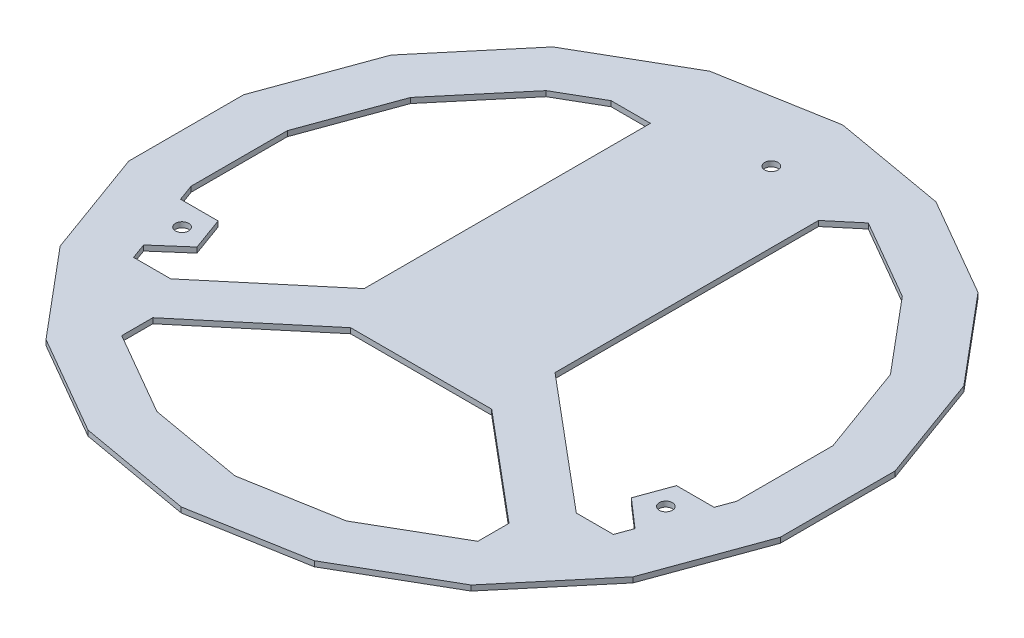
from build123d import *

# Parameters (mm, degrees)
BOSS_EXTRUDE1_DEPTH    = 1.2
BOSS_EXTRUDE17_DEPTH   = 1.2
BOSS_EXTRUDE17_2_DEPTH = 1.2
BOSS_EXTRUDE17_3_DEPTH = 1.2
SKETCH18_W             = 18
SKETCH18_H             = 25
BOSS_EXTRUDE18_DEPTH   = 1.2
BOSS_EXTRUDE19_DEPTH   = 1.2
BOSS_EXTRUDE20_DEPTH   = 1.2
BOSS_EXTRUDE22_DEPTH   = 1.2
BOSS_EXTRUDE26_DEPTH   = 1.2
BOSS_EXTRUDE28_DEPTH   = 1.2
BOSS_EXTRUDE23_DEPTH   = 1.2
SKETCH38_R             = 1.5
CUT_EXTRUDE2_DEPTH     = 1.2
BOSS_EXTRUDE29_DEPTH   = 1.2
SKETCH37_R             = 1.5
CUT_EXTRUDE3_DEPTH     = 1.2
BOSS_EXTRUDE30_DEPTH   = 1.2
CUT_EXTRUDE4_DEPTH     = 1.2


with BuildPart() as part:
    # Sketch1 → Boss-Extrude1 (new body)
    with BuildSketch(Plane(origin=(0, 0, 0), x_dir=(1, 0, 0), z_dir=(0, 1, 0))):
        Polygon((0, 75), (-25.651510749, 70.476946559), (-48.209070726, 57.453333234), (-64.951905284, 37.5), (-73.860581476, 13.023613325), (-73.860581476, -13.023613325), (-64.951905284, -37.5), (-48.209070726, -57.453333234), (-25.651510749, -70.476946559), (0, -75), (25.651510749, -70.476946559), (48.209070726, -57.453333234), (64.951905284, -37.5), (73.860581476, -13.023613325), (73.860581476, 13.023613325), (64.951905284, 37.5), (48.209070726, 57.453333234), (25.651510749, 70.476946559), align=None)
        Polygon((0, 62.814880657), (-21.483954485, 59.026679829), (-40.37662699, 48.118990273), (-54.399282385, 31.407440329), (-61.860581476, 10.907689557), (-61.860581476, -10.907689557), (-54.399282385, -31.407440329), (-40.37662699, -48.118990273), (-21.483954485, -59.026679829), (0, -62.814880657), (21.483954485, -59.026679829), (40.37662699, -48.118990273), (54.399282385, -31.407440329), (61.860581476, -10.907689557), (61.860581476, 10.907689557), (54.399282385, 31.407440329), (40.37662699, 48.118990273), (21.483954485, 59.026679829), align=None, mode=Mode.SUBTRACT)
    extrude(amount=BOSS_EXTRUDE1_DEPTH)



with BuildPart() as body_2:
    # Sketch15 → Boss-Extrude17 (new body)
    with BuildSketch(Plane.XZ):
        Polygon((0, -101.401091909), (34.681215988, -95.285857807), (36.930290738, -93.987353894), (36.930290738, -84.749749587), (31.902845145, -87.652346653), (0, -93.277679014), (-31.902845145, -87.652346653), (-36.930290738, -84.749749587), (-36.930290738, -93.987353894), (-34.681215988, -95.285857807), align=None)
    extrude(amount=-BOSS_EXTRUDE17_DEPTH)


with BuildPart() as body_3:
    # Sketch15 → Boss-Extrude17 2 (new body)
    with BuildSketch(Plane.XZ):
        Polygon((92.620527368, -37.5), (99.860581476, -17.608114823), (99.860581476, 17.608114823), (92.620527368, 37.5), (84.107105188, 37.5), (91.860581476, 16.197498978), (91.860581476, -16.197498978), (84.107105188, -37.5), align=None)
    extrude(amount=-BOSS_EXTRUDE17_2_DEPTH)


with BuildPart() as body_4:
    # Sketch15 → Boss-Extrude17 3 (new body)
    with BuildSketch(Plane.XZ):
        Polygon((-92.620527368, 37.5), (-99.860581476, 17.608114823), (-99.860581476, -17.608114823), (-92.620527368, -37.5), (-84.107105188, -37.5), (-91.860581476, -16.197498978), (-91.860581476, 16.197498978), (-84.107105188, 37.5), align=None)
    extrude(amount=-BOSS_EXTRUDE17_3_DEPTH)


with BuildPart() as part_1:
    add(part.part)

    add(body_2.part)  # Boss-Extrude18 merges body 2

    add(body_3.part)  # Boss-Extrude18 merges body 3

    add(body_4.part)  # Boss-Extrude18 merges body 4
    # Sketch18 → Boss-Extrude18 (add)
    with BuildSketch(Plane.XZ):
        with Locations((-82.860581476, 0)):
            Rectangle(SKETCH18_W, SKETCH18_H)
        with Locations((82.860581476, 0)):
            Rectangle(SKETCH18_W, SKETCH18_H)
        Polygon((-12.5, -72.795912741), (-12.5, -91.073591755), (0, -93.277679014), (12.5, -91.073591755), (12.5, -72.795912741), (0, -75), align=None)
    extrude(amount=-BOSS_EXTRUDE18_DEPTH)

    # Sketch19 → Boss-Extrude19 (add)
    with BuildSketch(Plane.XZ):
        Polygon((-91.860581476, 16.197498978), (-82.860581476, 12.5), (-91.860581476, 12.5), align=None)
        Polygon((-91.860581476, -16.197498978), (-82.860581476, -12.5), (-91.860581476, -12.5), align=None)
        Polygon((91.860581476, 16.197498978), (82.860581476, 12.5), (91.860581476, 12.5), align=None)
        Polygon((91.860581476, -16.197498978), (82.860581476, -12.5), (91.860581476, -12.5), align=None)
        Polygon((22.201422573, -89.362969204), (12.5, -81.934752248), (12.5, -91.073591755), align=None)
        Polygon((-12.5, -81.934752248), (-12.5, -91.073591755), (-22.201422573, -89.362969204), align=None)
    extrude(amount=-BOSS_EXTRUDE19_DEPTH)

    # Sketch20 → Boss-Extrude20 (add)
    with BuildSketch(Plane.XZ):
        Polygon((-36.930290738, 63.965139896), (-36.930290738, 91.965139896), (-32.052421992, 91.965139896), (-12.825755375, 72.738473279), (-25.651510749, 70.476946559), align=None)
        Polygon((36.930290738, 63.965139896), (36.930290738, 91.965139896), (32.052421992, 91.965139896), (12.825755375, 72.738473279), (25.651510749, 70.476946559), align=None)
    extrude(amount=-BOSS_EXTRUDE20_DEPTH)

    # Sketch24 → Boss-Extrude22 (add)
    with BuildSketch(Plane(origin=(0, 1.2, 0), x_dir=(1, 0, 0), z_dir=(0, 1, 0))):
        Polygon((-36.930290738, 93.987353894), (-36.930290738, 80.130947434), (-30.513659724, 83.835591077), (-17.889679207, 86.061539446), (17.889679207, 86.061539446), (30.513659724, 83.835591077), (36.930290738, 80.130947434), (36.930290738, 93.987353894), (34.681215988, 95.285857807), (0, 101.401091909), (-34.681215988, 95.285857807), align=None)
    extrude(amount=-BOSS_EXTRUDE22_DEPTH)

    # Sketch27 → Boss-Extrude26 (add)
    with BuildSketch(Plane.XZ):
        Polygon((-50.923286541, 35.549970864), (-43.852622834, 43.976459738), (-16, 20.60533419), (16, 20.60533419), (43.852622834, 43.976459738), (50.923286541, 35.549970864), (16, 6.245854008), (16, -59.993648966), (0, -62.814880657), (-16, -59.993648966), (-16, 6.245854008), align=None)
    extrude(amount=-BOSS_EXTRUDE26_DEPTH)

    # Sketch43 → Boss-Extrude28 (add)
    with BuildSketch(Plane.XZ):
        Polygon((-40.37662699, 48.118990273), (-40.37662699, 41.059752907), (-43.852622834, 43.976459738), align=None)
        Polygon((40.37662699, 48.118990273), (40.37662699, 41.059752907), (43.852622834, 43.976459738), align=None)
        Polygon((54.399282385, 31.407440329), (45.986410894, 31.407440329), (50.923286541, 35.549970864), align=None)
        Polygon((-54.399282385, 31.407440329), (-45.986410894, 31.407440329), (-50.923286541, 35.549970864), align=None)
        Polygon((-22.128355545, -58.654634704), (-16, -53.512333827), (-16, -59.993648966), (-21.483954485, -59.026679829), align=None)
        Polygon((16, -59.993648966), (16, -53.512333827), (22.128355545, -58.654634704), (21.483954485, -59.026679829), align=None)
    extrude(amount=-BOSS_EXTRUDE28_DEPTH)

    # Sketch26 → Boss-Extrude23 (add)
    with BuildSketch(Plane(origin=(0, 1.2, 0), x_dir=(1, 0, 0), z_dir=(0, 1, 0))):
        Polygon((-36.930290738, 93.987353894), (-45.930290738, 88.791201472), (-45.930290738, 74.934795011), (-36.930290738, 80.130947434), align=None)
        Polygon((36.930290738, 93.987353894), (45.930290738, 88.791201472), (45.930290738, 74.934795011), (36.930290738, 80.130947434), align=None)
    extrude(amount=-BOSS_EXTRUDE23_DEPTH)

    # Sketch38 → Cut-Extrude2 (cut)
    with BuildSketch(Plane(origin=(0, 1.2, 0), x_dir=(1, 0, 0), z_dir=(0, 1, 0))):
        with Locations(Location((0, 58.81204127, 0), (0, 0, 270))):
            Circle(SKETCH38_R)
    extrude(amount=-CUT_EXTRUDE2_DEPTH, mode=Mode.SUBTRACT)

    # Sketch34 → Boss-Extrude29 (add)
    with BuildSketch(Plane(origin=(0, 1.2, 0), x_dir=(1, 0, 0), z_dir=(0, 1, 0))):
        Polygon((-60.493893717, -14.662633313), (-55.705611711, -27.818330004), (-49.244310391, -22.180174279), (-50.612390964, -18.421403796), (-51.980471537, -14.662633313), align=None)
        Polygon((50.612390964, -18.421403796), (49.244310391, -22.180174279), (55.705611711, -27.818330004), (60.493893717, -14.662633313), (51.980471537, -14.662633313), align=None)
    extrude(amount=-BOSS_EXTRUDE29_DEPTH)

    # Sketch37 → Cut-Extrude3 (cut)
    with BuildSketch(Plane(origin=(0, 1.2, 0), x_dir=(1, 0, 0), z_dir=(0, 1, 0))):
        with Locations(Location((-54.84814578, -19.96309247, 0), (0, 0, 270))):
            Circle(SKETCH37_R)
        with Locations(Location((54.84814578, -19.96309247, 0), (0, 0, 270))):
            Circle(SKETCH37_R)
    extrude(amount=-CUT_EXTRUDE3_DEPTH, mode=Mode.SUBTRACT)

    # Sketch44 → Boss-Extrude30 (add)
    with BuildSketch(Plane.XZ):
        Polygon((-22.128355545, 11.388154885), (-16, 6.245854008), (-16, -53.512333827), (-22.128355545, -58.654634704), (-31.035081933, -53.512333827), (-22.128355545, -53.512333827), align=None)
    extrude(amount=-BOSS_EXTRUDE30_DEPTH)

    # Sketch46 → Cut-Extrude4 (cut)
    with BuildSketch(Plane.XZ):
        Polygon((-73.860581476, -13.023613325), (-84.107105188, -37.5), (-92.620527368, -37.5), (-99.860581476, -17.608114823), (-99.860581476, 17.608114823), (-92.620527368, 37.5), (-84.107105188, 37.5), (-73.860581476, 12.5), align=None)
        Polygon((73.860581476, 12.5), (84.107105188, 37.5), (92.620527368, 37.5), (99.860581476, 17.608114823), (99.860581476, -17.608114823), (92.620527368, -37.5), (84.107105188, -37.5), (73.860581476, -12.5), align=None)
        Polygon((-12.5, -72.795912741), (-45.930290738, -74.934795011), (-45.930290738, -88.791201472), (-34.681215988, -95.285857807), (0, -101.401091909), (34.681215988, -95.285857807), (45.930290738, -88.791201472), (45.930290738, -74.934795011), (12.5, -72.795912741), (0, -75), align=None)
        Polygon((-36.930290738, 63.965139896), (-36.930290738, 91.965139896), (-32.052421992, 91.965139896), (-12.825755375, 72.738473279), (-25.651510749, 70.476946559), align=None)
        Polygon((12.825755375, 72.738473279), (32.052421992, 91.965139896), (36.930290738, 91.965139896), (36.930290738, 63.965139896), (25.651510749, 70.476946559), align=None)
    extrude(amount=-CUT_EXTRUDE4_DEPTH, mode=Mode.SUBTRACT)


solid = part_1.part
